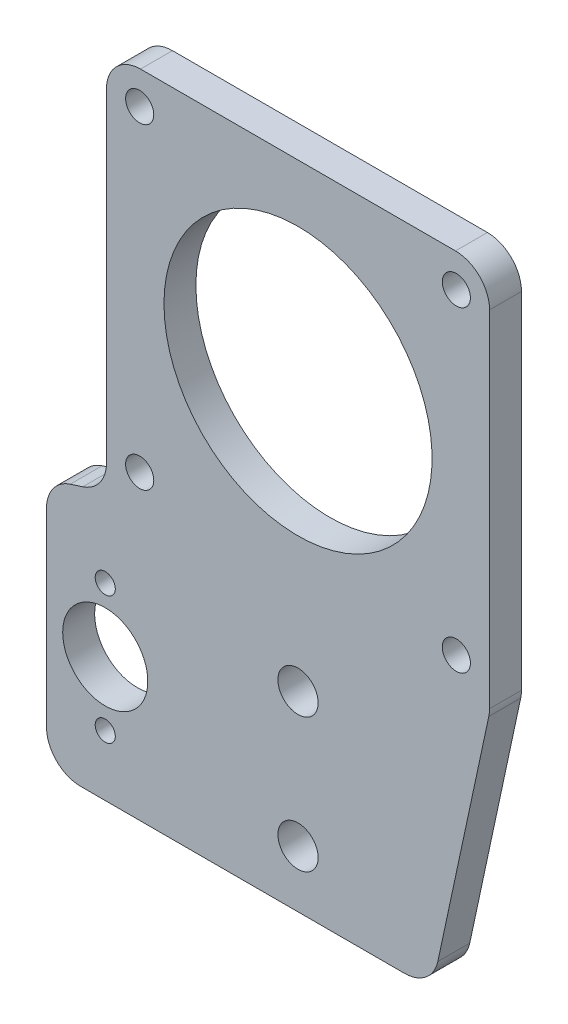
from build123d import *

# Parameters (mm, degrees)
SKETCH1_R                    = 6.349999995
SKETCH1_R_2                  = 2.75
SKETCH1_R_3                  = 2.999999999
SKETCH1_R_4                  = 20
BOSS_EXTRUDE1_DEPTH          = 4.7625
FILLET1_R                    = 5.08
M5_TAPPED_HOLE1_D            = 4.2
M5_TAPPED_HOLE1_DEPTH        = 14
M5_TAPPED_HOLE1_TIP          = 1.2618073
F_3_0_3_DIAMETER_HOLE1_D     = 3
F_3_0_3_DIAMETER_HOLE1_DEPTH = 25.4
F_3_0_3_DIAMETER_HOLE1_TIP   = 0.901290929


with BuildPart() as part:
    # Sketch1 → Boss-Extrude1 (new body)
    # profile 1 of 6: a face of its own
    with BuildSketch(Plane.XY):
        Polygon((0, 57.15), (0, 0), (-8.945, -2.86), (-8.945, -40), (8.575, -40), (48.575, -40), (57.15, 0), (57.15, 57.15), align=None)
        with Locations(Location((-0.185, -21.43, 0), (0, 0, 180))):
            Circle(SKETCH1_R, mode=Mode.SUBTRACT)
        with Locations((4.953, 4.989071325)):
            Circle(SKETCH1_R_2, mode=Mode.SUBTRACT)
        with Locations(Location((28.575, -31.5, 0), (0, 0, 180))):
            Circle(SKETCH1_R_3, mode=Mode.SUBTRACT)
        with Locations(Location((28.575, -11.5, 0), (0, 0, 180))):
            Circle(SKETCH1_R_3, mode=Mode.SUBTRACT)
        with Locations((52.197, 4.989071325)):
            Circle(SKETCH1_R_2, mode=Mode.SUBTRACT)
        with Locations((4.953, 52.233071325)):
            Circle(SKETCH1_R_2, mode=Mode.SUBTRACT)
        with Locations(Location((28.575, 28.575, 0), (0, 0, 180))):
            Circle(SKETCH1_R_4, mode=Mode.SUBTRACT)
        with Locations((52.197, 52.197)):
            Circle(SKETCH1_R_2, mode=Mode.SUBTRACT)
    # profile 2 of 6: a face of its own
    with BuildSketch(Plane.XY):
        Polygon((0, 57.15), (0, 0), (-8.945, -2.86), (-8.945, -40), (8.575, -40), (48.575, -40), (57.15, 0), (57.15, 57.15), align=None)
        with Locations(Location((-0.185, -21.43, 0), (0, 0, 180))):
            Circle(SKETCH1_R, mode=Mode.SUBTRACT)
        with Locations((4.953, 4.989071325)):
            Circle(SKETCH1_R_2, mode=Mode.SUBTRACT)
        with Locations(Location((28.575, -31.5, 0), (0, 0, 180))):
            Circle(SKETCH1_R_3, mode=Mode.SUBTRACT)
        with Locations(Location((28.575, -11.5, 0), (0, 0, 180))):
            Circle(SKETCH1_R_3, mode=Mode.SUBTRACT)
        with Locations((52.197, 4.989071325)):
            Circle(SKETCH1_R_2, mode=Mode.SUBTRACT)
        with Locations((4.953, 52.233071325)):
            Circle(SKETCH1_R_2, mode=Mode.SUBTRACT)
        with Locations(Location((28.575, 28.575, 0), (0, 0, 180))):
            Circle(SKETCH1_R_4, mode=Mode.SUBTRACT)
        with Locations((52.197, 52.197)):
            Circle(SKETCH1_R_2, mode=Mode.SUBTRACT)
    # profile 3 of 6: a face of its own
    with BuildSketch(Plane.XY):
        with Locations((4.953, 52.233071325)):
            Circle(SKETCH1_R_2)
    # profile 4 of 6: a face of its own
    with BuildSketch(Plane.XY):
        with Locations((52.197, 52.197)):
            Circle(SKETCH1_R_2)
    # profile 5 of 6: a face of its own
    with BuildSketch(Plane.XY):
        with Locations((4.953, 4.989071325)):
            Circle(SKETCH1_R_2)
    # profile 6 of 6: a face of its own
    with BuildSketch(Plane.XY):
        with Locations((52.197, 4.989071325)):
            Circle(SKETCH1_R_2)
    extrude(amount=BOSS_EXTRUDE1_DEPTH)

    # Fillet1
    fillet1_edges = [part.edges().sort_by_distance(p)[0] for p in [
        (-8.945, -40, 2.38125),
        (-8.945, -2.86, 2.38125),
        (0, 0, 2.38125),
        (0, 57.15, 2.38125),
        (57.15, 57.15, 2.38125),
        (57.15, 0, 2.38125),
        (48.575, -40, 2.38125),
    ]]
    fillet(fillet1_edges, radius=FILLET1_R)

    # M5 Tapped Hole1
    with Locations(Plane.XY.offset(4.7625)):
        with Locations((4.953, 52.233071325), (52.197, 52.197), (52.197, 4.989071325), (4.953, 4.989071325)):
            Hole(M5_TAPPED_HOLE1_D / 2, depth=M5_TAPPED_HOLE1_DEPTH)
            with Locations((0, 0, -(M5_TAPPED_HOLE1_DEPTH + M5_TAPPED_HOLE1_TIP / 2))):  # 118° drill point
                Cone(0, M5_TAPPED_HOLE1_D / 2, M5_TAPPED_HOLE1_TIP, mode=Mode.SUBTRACT)

    # Ø3.0 (3) Diameter Hole1
    with Locations(Plane(origin=(0, 0, 0), x_dir=(-1, 0, 0), z_dir=(0, 0, -1))):
        with Locations((0.185, -30.96), (0.185, -11.9)):
            Hole(F_3_0_3_DIAMETER_HOLE1_D / 2, depth=F_3_0_3_DIAMETER_HOLE1_DEPTH)
            with Locations((0, 0, -(F_3_0_3_DIAMETER_HOLE1_DEPTH + F_3_0_3_DIAMETER_HOLE1_TIP / 2))):  # 118° drill point
                Cone(0, F_3_0_3_DIAMETER_HOLE1_D / 2, F_3_0_3_DIAMETER_HOLE1_TIP, mode=Mode.SUBTRACT)


solid = part.part
